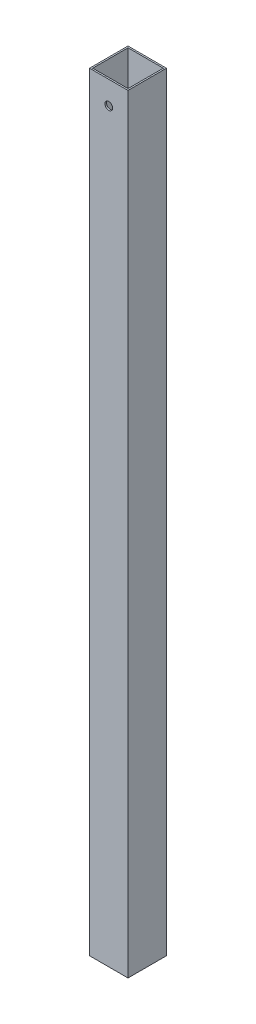
from build123d import *

# Parameters (mm, degrees)
ESBO_O1_W                  = 50
ESBO_O1_H                  = 50
ESBO_O1_W_2                = 46
ESBO_O1_H_2                = 46
RESSALTO_EXTRUS_O1_DEPTH   = 1000
CORTE_EXTRUS_O1_DEPTH      = 1002.561281201
CORTE_EXTRUS_O1_DEPTH_BACK = 1002.561281201
ESBO_O2_R                  = 5


with BuildPart() as part:
    # Esboço1 → Ressalto-extrusão1 (new body)
    with BuildSketch(Plane(origin=(0, 0, 0), x_dir=(1, 0, 0), z_dir=(0, 1, 0))):
        Rectangle(ESBO_O1_W, ESBO_O1_H)
        Rectangle(ESBO_O1_W_2, ESBO_O1_H_2, mode=Mode.SUBTRACT)
    extrude(amount=RESSALTO_EXTRUS_O1_DEPTH)

    # Esboço2 → Corte-extrusão1 (cut, two sides: drawn at the far end of the back side and taken through both)
    with BuildSketch(Plane.XY.offset(25).offset(-CORTE_EXTRUS_O1_DEPTH_BACK)):
        with Locations(Location((0, 970, 0), (0, 0, 180))):
            Circle(ESBO_O2_R)
    extrude(amount=CORTE_EXTRUS_O1_DEPTH + CORTE_EXTRUS_O1_DEPTH_BACK, mode=Mode.SUBTRACT)


solid = part.part
